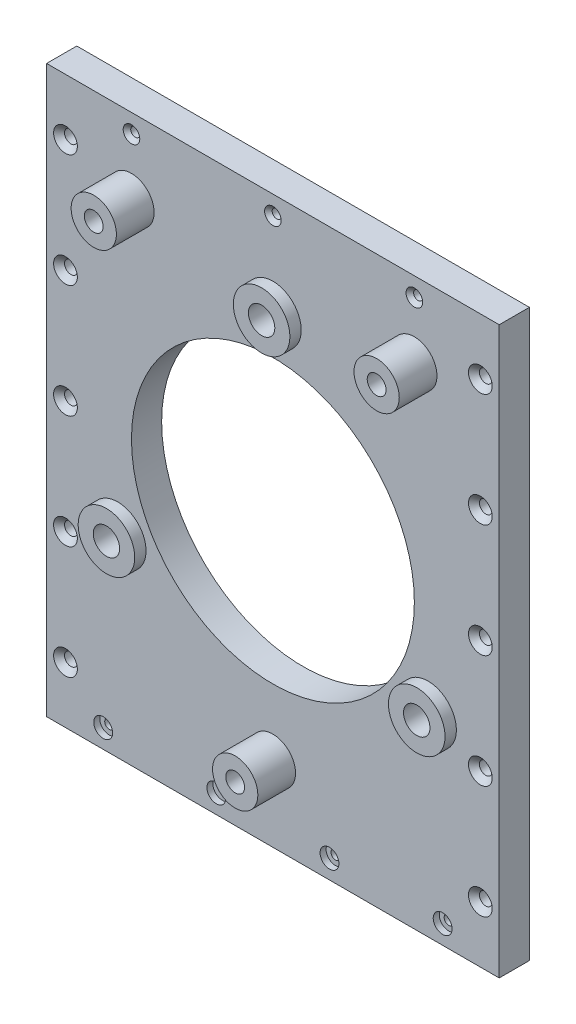
from build123d import *

# Parameters (mm, degrees)
SKETCH1_W                                     = 120
SKETCH1_H                                     = 150
EXTRUDE1_DEPTH                                = 8
SKETCH2_R                                     = 37.5
EXTRUDE2_DEPTH                                = 193.260240299
SKETCH3_R                                     = 7.5
EXTRUDE3_DEPTH                                = 3
SKETCH4_R                                     = 6
EXTRUDE4_DEPTH                                = 10
TAPPED_HOLE1_D                                = 4.2
TAPPED_HOLE1_DEPTH                            = 14
TAPPED_HOLE1_CBORE_D                          = 5
TAPPED_HOLE1_CBORE_DEPTH                      = 10
TAPPED_HOLE1_TIP                              = 1.2618073
SKETCH7_R                                     = 3.5
EXTRUDE5_DEPTH                                = 193.408419774
CSK_FOR_FLAT_HEAD_MACHINE_SCREW1_D            = 3.4
CSK_FOR_FLAT_HEAD_MACHINE_SCREW1_CSINK_D      = 6.3
CSK_FOR_FLAT_HEAD_MACHINE_SCREW1_CSINK_ANGLE  = 90
LPATTERN1_COUNT                               = 5
LPATTERN1_PITCH                               = 30
LPATTERN1_COUNT_DIR2                          = 2
LPATTERN1_PITCH_DIR2                          = 110
CBORE_FOR_PAN_HEAD_MACHINE_SCREW2_D           = 2.4
CBORE_FOR_PAN_HEAD_MACHINE_SCREW2_CBORE_D     = 5
CBORE_FOR_PAN_HEAD_MACHINE_SCREW2_CBORE_DEPTH = 1.6
LPATTERN2_COUNT                               = 4
LPATTERN2_PITCH                               = 30
CSK_FOR_FLAT_HEAD_MACHINE_SCREW2_D            = 2.4
CSK_FOR_FLAT_HEAD_MACHINE_SCREW2_CSINK_D      = 4.4
CSK_FOR_FLAT_HEAD_MACHINE_SCREW2_CSINK_ANGLE  = 90
LPATTERN3_COUNT                               = 3
LPATTERN3_PITCH                               = 37.5


with BuildPart() as part:
    # Sketch1 → Extrude1 (new body)
    with BuildSketch(Plane.XY):
        with Locations((60, 75)):
            Rectangle(SKETCH1_W, SKETCH1_H)
    extrude(amount=-EXTRUDE1_DEPTH)

    # Sketch2 → Extrude2 (cut, through all)
    with BuildSketch(Plane.XY):
        with Locations((60, 75)):
            Circle(SKETCH2_R)
    extrude(amount=-EXTRUDE2_DEPTH, mode=Mode.SUBTRACT)

    # Sketch3 → Extrude3 (add)
    with BuildSketch(Plane.XY):
        with Locations(Location((60, 122.5, 0), (0, 0, 180))):
            Circle(SKETCH3_R)
        with Locations(Location((101.13620668, 51.25, 0), (0, 0, 180))):
            Circle(SKETCH3_R)
        with Locations(Location((18.86379332, 51.25, 0), (0, 0, 180))):
            Circle(SKETCH3_R)
    extrude(amount=EXTRUDE3_DEPTH)

    # Sketch4 → Extrude4 (add)
    with BuildSketch(Plane.XY):
        with Locations(Location((22.5, 130, 0), (0, 0, 180))):
            Circle(SKETCH4_R)
        with Locations(Location((97.5, 130, 0), (0, 0, 180))):
            Circle(SKETCH4_R)
        with Locations(Location((60, 20, 0), (0, 0, 180))):
            Circle(SKETCH4_R)
    extrude(amount=EXTRUDE4_DEPTH)

    # Tapped Hole1
    with Locations(Plane.XY.offset(10)):
        with Locations((22.5, 130), (97.5, 130), (60, 20)):
            CounterBoreHole(TAPPED_HOLE1_D / 2, TAPPED_HOLE1_CBORE_D / 2, TAPPED_HOLE1_CBORE_DEPTH, depth=TAPPED_HOLE1_DEPTH)
            with Locations((0, 0, -(TAPPED_HOLE1_DEPTH + TAPPED_HOLE1_TIP / 2))):  # 118° drill point
                Cone(0, TAPPED_HOLE1_D / 2, TAPPED_HOLE1_TIP, mode=Mode.SUBTRACT)

    # Sketch7 → Extrude5 (cut, through all)
    with BuildSketch(Plane.XY.offset(3)):
        with Locations((60, 122.5)):
            Circle(SKETCH7_R)
        with Locations((101.13620668, 51.25)):
            Circle(SKETCH7_R)
        with Locations((18.86379332, 51.25)):
            Circle(SKETCH7_R)
    extrude(amount=-EXTRUDE5_DEPTH, mode=Mode.SUBTRACT)

    # CSK for  Flat Head Machine Screw1 (through all)
    with Locations(Plane.XY):
        with Locations((5, 15)):
            csk_for_flat_head_machine_screw1 = CounterSinkHole(CSK_FOR_FLAT_HEAD_MACHINE_SCREW1_D / 2, CSK_FOR_FLAT_HEAD_MACHINE_SCREW1_CSINK_D / 2, counter_sink_angle=CSK_FOR_FLAT_HEAD_MACHINE_SCREW1_CSINK_ANGLE)

    # LPattern1: CSK for Flat Head Machine Screw1 5 × 2
    with Locations(*[(j * LPATTERN1_PITCH_DIR2, i * LPATTERN1_PITCH, 0) for i in range(LPATTERN1_COUNT) for j in range(LPATTERN1_COUNT_DIR2) if (i, j) != (0, 0)]):
        add(csk_for_flat_head_machine_screw1, mode=Mode.SUBTRACT)

    # CBORE for  Pan Head Machine Screw2 (through all)
    with Locations(Plane.XY):
        with Locations((15, 5)):
            cbore_for_pan_head_machine_screw2 = CounterBoreHole(CBORE_FOR_PAN_HEAD_MACHINE_SCREW2_D / 2, CBORE_FOR_PAN_HEAD_MACHINE_SCREW2_CBORE_D / 2, CBORE_FOR_PAN_HEAD_MACHINE_SCREW2_CBORE_DEPTH)

    # LPattern2: CBORE for  Pan Head Machine Screw2 ×4
    with Locations(*[(i * LPATTERN2_PITCH, 0, 0) for i in range(1, LPATTERN2_COUNT)]):
        add(cbore_for_pan_head_machine_screw2, mode=Mode.SUBTRACT)

    # CSK for  Flat Head Machine Screw2 (through all)
    with Locations(Plane.XY):
        with Locations((22.5, 145)):
            csk_for_flat_head_machine_screw2 = CounterSinkHole(CSK_FOR_FLAT_HEAD_MACHINE_SCREW2_D / 2, CSK_FOR_FLAT_HEAD_MACHINE_SCREW2_CSINK_D / 2, counter_sink_angle=CSK_FOR_FLAT_HEAD_MACHINE_SCREW2_CSINK_ANGLE)

    # LPattern3: CSK for  Flat Head Machine Screw2 ×3
    with Locations(*[(i * LPATTERN3_PITCH, 0, 0) for i in range(1, LPATTERN3_COUNT)]):
        add(csk_for_flat_head_machine_screw2, mode=Mode.SUBTRACT)


solid = part.part
